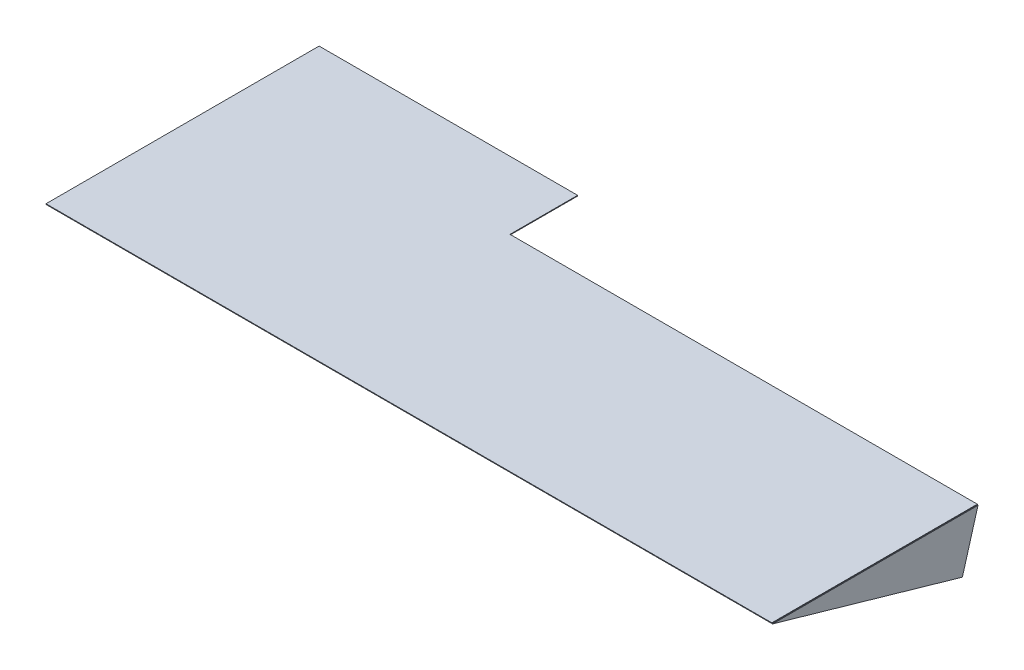
from build123d import *

# Parameters (mm, degrees)
EXTRUDE_1_DEPTH = 10
EXTRUDE_2_DEPTH = 10


with BuildPart() as part:
    # Эскиз1 → Бобышка-Вытянуть1 (new body)
    with BuildSketch(Plane(origin=(0, 0, 0), x_dir=(1, 0, 0), z_dir=(0, 1, 0))):
        Polygon((0, 0), (10950, 0), (10950, 3100), (3900, 3100), (3900, 4120), (0, 4120), align=None)
    extrude(amount=EXTRUDE_1_DEPTH)


with BuildPart() as body_2:
    # Эскиз2 → Бобышка-Вытянуть2 (new body)
    with BuildSketch(Plane(origin=(10950, 0, 0), x_dir=(0, 0, -1), z_dir=(1, 0, 0))):
        Polygon((0, 0), (2864.474549042, -821.374859561), (3100, 0), align=None)
    extrude(amount=EXTRUDE_2_DEPTH)


solid = Compound([part.part, body_2.part])
